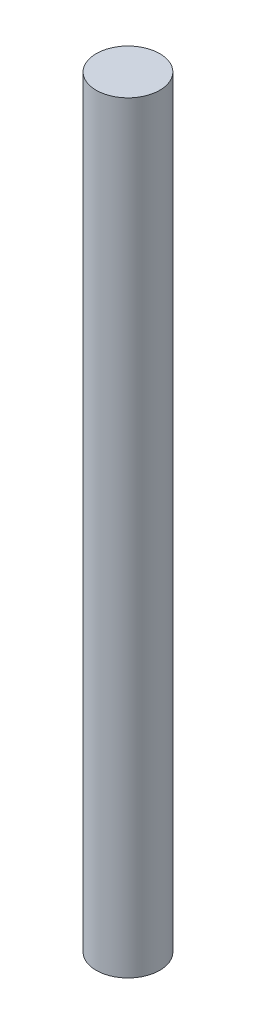
from build123d import *

# Parameters (mm, degrees)
SKETCH1_R           = 1.190625
BOSS_EXTRUDE1_DEPTH = 28.575


with BuildPart() as part:
    # Sketch1 → Boss-Extrude1 (new body)
    with BuildSketch(Plane(origin=(0, 0, 0), x_dir=(1, 0, 0), z_dir=(0, 1, 0))):
        with Locations(Location((0, 0, 0), (0, 0, 270))):
            Circle(SKETCH1_R)
    extrude(amount=BOSS_EXTRUDE1_DEPTH)


solid = part.part
